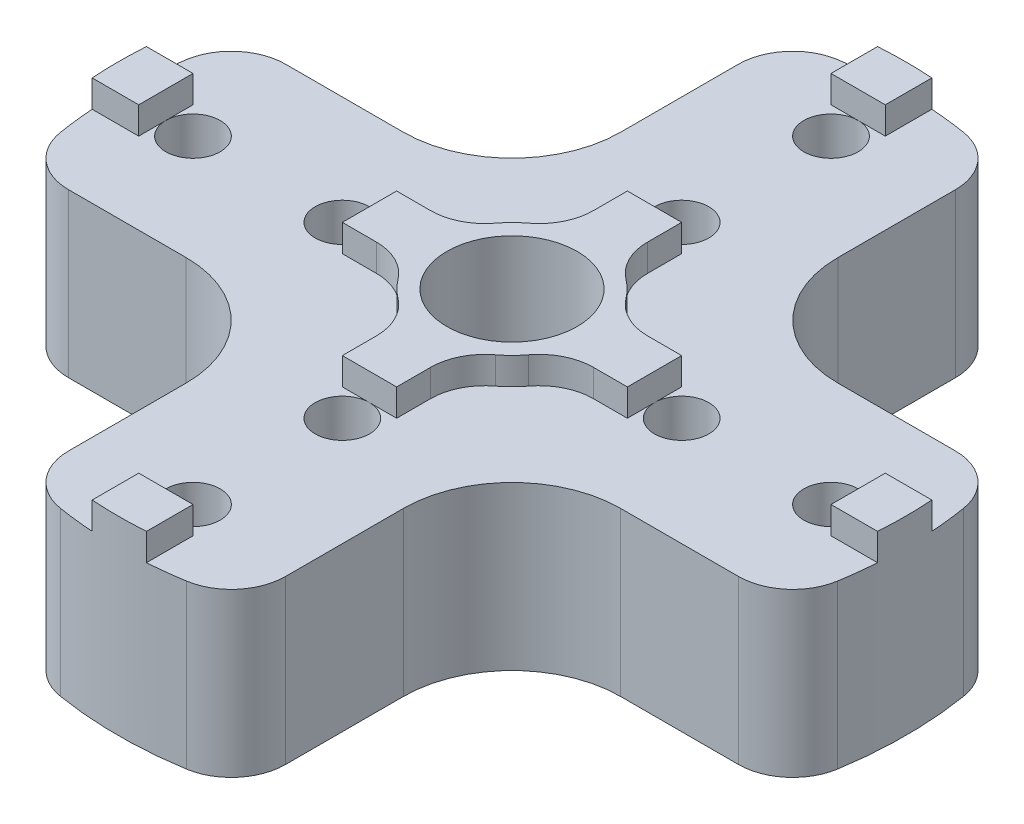
from build123d import *

# Parameters (mm, degrees)
BOSS_EXTRUDE1_DEPTH                             = 2.5
BOSS_EXTRUDE1_DEPTH_BACK                        = 0.5
BOSS_EXTRUDE2_DEPTH                             = 0.5
FILLET1_R                                       = 1
CUT_EXTRUDE1_START                              = -3
SKETCH5_R                                       = 0.5
CUT_EXTRUDE1_DEPTH                              = 3
SKETCH10_W                                      = 1
SKETCH10_H                                      = 3.75
SKETCH10_W_2                                    = 3.75
SKETCH10_H_2                                    = 1
CUT_EXTRUDE2_DEPTH                              = 0.5
SKETCH17_R                                      = 1.5
BOSS_EXTRUDE3_DEPTH                             = 0.5
CSK_FOR_M2_FLAT_HEAD_MACHINE_SCREW1_D           = 2.4
CSK_FOR_M2_FLAT_HEAD_MACHINE_SCREW1_DEPTH       = 6
CSK_FOR_M2_FLAT_HEAD_MACHINE_SCREW1_CSINK_D     = 4.4
CSK_FOR_M2_FLAT_HEAD_MACHINE_SCREW1_CSINK_ANGLE = 90
CSK_FOR_M2_FLAT_HEAD_MACHINE_SCREW1_TIP         = 0.721032743
FILLET2_R                                       = 2
FILLET3_R                                       = 1


with BuildPart() as part:
    # Sketch3 → Boss-Extrude1 (new, two sides: drawn at the far end of the back side and taken through both)
    with BuildSketch(Plane(origin=(0, 0, 0), x_dir=(1, 0, 0), z_dir=(0, 1, 0)).offset(-BOSS_EXTRUDE1_DEPTH_BACK)):
        with BuildLine():
            Line((-2, -6.968679932), (-2, -2))
            Line((-2, -2), (-6.968679932, -2))
            ThreePointArc((-6.968679932, -2), (-7.179325508, -1.009844169), (-7.25, 0))
            ThreePointArc((-7.25, 0), (-7.179325508, 1.009844169), (-6.968679932, 2))
            Line((-6.968679932, 2), (-2, 2))
            Line((-2, 2), (-2, 6.968679932))
            ThreePointArc((-2, 6.968679932), (-1.009844169, 7.179325508), (0, 7.25))
            ThreePointArc((0, 7.25), (1.009844169, 7.179325508), (2, 6.968679932))
            Line((2, 6.968679932), (2, 2))
            Line((2, 2), (6.968679932, 2))
            ThreePointArc((6.968679932, 2), (7.179325508, 1.009844169), (7.25, 0))
            ThreePointArc((7.25, 0), (7.179325508, -1.009844169), (6.968679932, -2))
            Line((6.968679932, -2), (2, -2))
            Line((2, -2), (2, -6.968679932))
            ThreePointArc((2, -6.968679932), (1.009844169, -7.179325508), (0, -7.25))
            ThreePointArc((0, -7.25), (-1.009844169, -7.179325508), (-2, -6.968679932))
        make_face()
    extrude(amount=BOSS_EXTRUDE1_DEPTH + BOSS_EXTRUDE1_DEPTH_BACK)

    # Sketch4 → Boss-Extrude2 (add)
    with BuildSketch(Plane(origin=(0, 2.5, 0), x_dir=(-1, 0, 0), z_dir=(0, 1, 0))):
        with BuildLine():
            Line((-0.5, 5.875), (-0.5, 7.232738071))
            ThreePointArc((-0.5, 7.232738071), (0, 7.25), (0.5, 7.232738071))
            Line((0.5, 7.232738071), (0.5, 5.875))
            ThreePointArc((0.5, 5.875), (0, 5.375), (-0.5, 5.875))
        make_face()
        with BuildLine():
            Line((0.5, 3.125), (0.5, 0.5))
            Line((0.5, 0.5), (3.125, 0.5))
            ThreePointArc((3.125, 0.5), (3.625, 0), (3.125, -0.5))
            Line((3.125, -0.5), (0.5, -0.5))
            Line((0.5, -0.5), (0.5, -3.125))
            ThreePointArc((0.5, -3.125), (0, -3.625), (-0.5, -3.125))
            Line((-0.5, -3.125), (-0.5, -0.5))
            Line((-0.5, -0.5), (-3.125, -0.5))
            ThreePointArc((-3.125, -0.5), (-3.625, 0), (-3.125, 0.5))
            Line((-3.125, 0.5), (-0.5, 0.5))
            Line((-0.5, 0.5), (-0.5, 3.125))
            ThreePointArc((-0.5, 3.125), (0, 3.625), (0.5, 3.125))
        make_face()
        with BuildLine():
            Line((5.875, 0.5), (7.232738071, 0.5))
            ThreePointArc((7.232738071, 0.5), (7.25, 0), (7.232738071, -0.5))
            Line((7.232738071, -0.5), (5.875, -0.5))
            ThreePointArc((5.875, -0.5), (5.375, 0), (5.875, 0.5))
        make_face()
        with BuildLine():
            Line((0.5, -5.875), (0.5, -7.232738071))
            ThreePointArc((0.5, -7.232738071), (0, -7.25), (-0.5, -7.232738071))
            Line((-0.5, -7.232738071), (-0.5, -5.875))
            ThreePointArc((-0.5, -5.875), (0, -5.375), (0.5, -5.875))
        make_face()
        with BuildLine():
            Line((-5.875, -0.5), (-7.232738071, -0.5))
            ThreePointArc((-7.232738071, -0.5), (-7.25, 0), (-7.232738071, 0.5))
            Line((-7.232738071, 0.5), (-5.875, 0.5))
            ThreePointArc((-5.875, 0.5), (-5.375, 0), (-5.875, -0.5))
        make_face()
    extrude(amount=BOSS_EXTRUDE2_DEPTH)

    # Fillet1
    fillet1_edges = [part.edges().sort_by_distance(p)[0] for p in [
        (-2, 1, 6.968679932),
        (-6.968679932, 1, 2),
        (-6.968679932, 1, -2),
        (-2, 1, -6.968679932),
        (2, 1, -6.968679932),
        (6.968679932, 1, -2),
        (6.968679932, 1, 2),
        (2, 1, 6.968679932),
    ]]
    fillet(fillet1_edges, radius=FILLET1_R)

    # Sketch5 → Cut-Extrude1 (cut)
    with BuildSketch(Plane(origin=(0, 3, 0), x_dir=(-1, 0, 0), z_dir=(0, 1, 0)).offset(CUT_EXTRUDE1_START)):
        with Locations(Location((0, 5.875, 0), (0, 0, 90))):
            Circle(SKETCH5_R)
        with Locations(Location((0, 3.125, 0), (0, 0, 90))):
            Circle(SKETCH5_R)
        with Locations(Location((5.875, 0, 0), (0, 0, 90))):
            Circle(SKETCH5_R)
        with Locations(Location((3.125, 0, 0), (0, 0, 90))):
            Circle(SKETCH5_R)
        with Locations(Location((0, -5.875, 0), (0, 0, 90))):
            Circle(SKETCH5_R)
        with Locations(Location((0, -3.125, 0), (0, 0, 90))):
            Circle(SKETCH5_R)
        with Locations(Location((-5.875, 0, 0), (0, 0, 90))):
            Circle(SKETCH5_R)
        with Locations(Location((-3.125, 0, 0), (0, 0, 90))):
            Circle(SKETCH5_R)
    extrude(amount=CUT_EXTRUDE1_DEPTH, mode=Mode.SUBTRACT)

    # Sketch10 → Cut-Extrude2 (cut)
    with BuildSketch(Plane(origin=(0, 3, 0), x_dir=(1, 0, 0), z_dir=(0, 1, 0))):
        with Locations((0, -4.5)):
            Rectangle(SKETCH10_W, SKETCH10_H)
        with Locations((-4.5, 0)):
            Rectangle(SKETCH10_W_2, SKETCH10_H_2)
        with Locations((0, 4.5)):
            Rectangle(SKETCH10_W, SKETCH10_H)
        with Locations((4.5, 0)):
            Rectangle(SKETCH10_W_2, SKETCH10_H_2)
    extrude(amount=-CUT_EXTRUDE2_DEPTH, mode=Mode.SUBTRACT)

    # Sketch17 → Boss-Extrude3 (add)
    with BuildSketch(Plane(origin=(0, 2.5, 0), x_dir=(1, 0, 0), z_dir=(0, 1, 0))):
        Circle(SKETCH17_R)
    extrude(amount=BOSS_EXTRUDE3_DEPTH)

    # CSK for M2 Flat Head Machine Screw1
    with Locations(Plane(origin=(0, -0.5, 0), x_dir=(-1, 0, 0), z_dir=(0, -1, 0))):
        with Locations((0, 0)):
            CounterSinkHole(CSK_FOR_M2_FLAT_HEAD_MACHINE_SCREW1_D / 2, CSK_FOR_M2_FLAT_HEAD_MACHINE_SCREW1_CSINK_D / 2, depth=CSK_FOR_M2_FLAT_HEAD_MACHINE_SCREW1_DEPTH, counter_sink_angle=CSK_FOR_M2_FLAT_HEAD_MACHINE_SCREW1_CSINK_ANGLE)
            with Locations((0, 0, -(CSK_FOR_M2_FLAT_HEAD_MACHINE_SCREW1_DEPTH + CSK_FOR_M2_FLAT_HEAD_MACHINE_SCREW1_TIP / 2))):  # 118° drill point
                Cone(0, CSK_FOR_M2_FLAT_HEAD_MACHINE_SCREW1_D / 2, CSK_FOR_M2_FLAT_HEAD_MACHINE_SCREW1_TIP, mode=Mode.SUBTRACT)

    # Fillet2
    fillet2_edges = [part.edges().sort_by_distance(p)[0] for p in [
        (-2, 1, 2),
        (-2, 1, -2),
        (2, 1, -2),
        (2, 1, 2),
    ]]
    fillet(fillet2_edges, radius=FILLET2_R)

    # Fillet3
    fillet3_edges = [part.edges().sort_by_distance(p)[0] for p in [
        (0.5, 2.75, 1.414213562),
        (1.414213562, 2.75, 0.5),
        (1.414213562, 2.75, -0.5),
        (0.5, 2.75, -1.414213562),
        (-0.5, 2.75, -1.414213562),
        (-1.414213562, 2.75, -0.5),
        (-1.414213562, 2.75, 0.5),
        (-0.5, 2.75, 1.414213562),
    ]]
    fillet(fillet3_edges, radius=FILLET3_R)


solid = part.part
